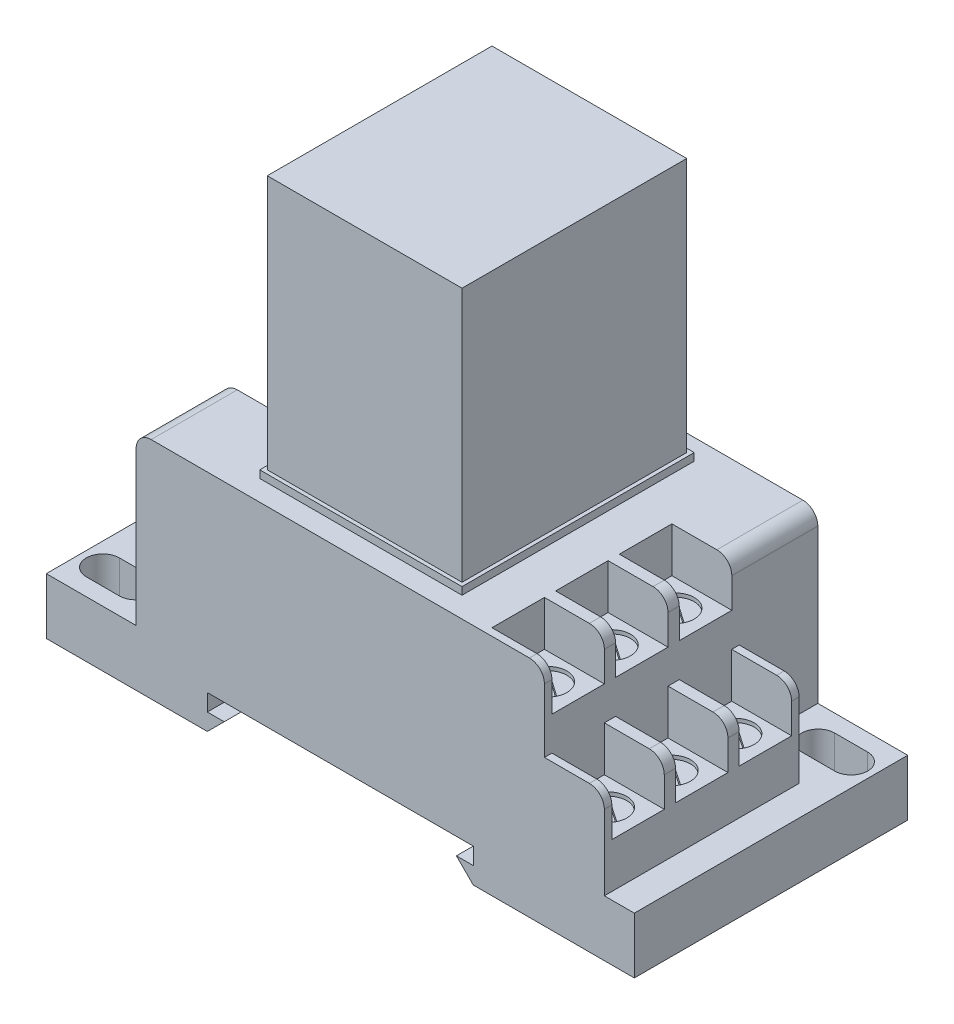
from build123d import *

# Parameters (mm, degrees)
SKETCH_1_W          = 78.5
SKETCH_1_H          = 36.5
EXTRUDE_1_DEPTH     = 30
CUT_EXTRUDE_1_DEPTH = 92.621504026
CUT_EXTRUDE_2_DEPTH = 92.621504026
EXTRUDE_2_DEPTH     = 26
EXTRUDE_6_DEPTH     = 26
CUT_EXTRUDE_3_DEPTH = 7.5
SKETCH_8_W          = 8
SKETCH_8_H          = 7
CUT_EXTRUDE_4_DEPTH = 6
SKETCH_9_W          = 8
SKETCH_9_H          = 7
CUT_EXTRUDE_5_DEPTH = 6
SKETCH_10_W         = 27
SKETCH_10_H         = 31
EXTRUDE_7_DEPTH     = 35
SKETCH_11_W         = 27
SKETCH_11_H         = 31
SKETCH_11_W_2       = 26
SKETCH_11_H_2       = 30
CUT_EXTRUDE_6_DEPTH = 34
SKETCH_12_W         = 8
SKETCH_12_H         = 7
SKETCH_12_H_2       = 7.017391642
CUT_EXTRUDE_7_DEPTH = 6
SKETCH_13_R         = 2.5
CUT_EXTRUDE_8_DEPTH = 1
EXTRUDE_8_DEPTH     = 0.5
SKETCH_15_R         = 2.5
CUT_EXTRUDE_9_DEPTH = 1
EXTRUDE_START       = 0.5
EXTRUDE_9_DEPTH     = 0.5


with BuildPart() as part:
    # Эскиз1 → Бобышка-Вытянуть1 (new body)
    with BuildSketch(Plane(origin=(0, 0, 0), x_dir=(1, 0, 0), z_dir=(0, 1, 0))):
        with Locations((39.25, 18.25)):
            Rectangle(SKETCH_1_W, SKETCH_1_H)
    extrude(amount=EXTRUDE_1_DEPTH)

    # Эскиз2 → Вырез-Вытянуть1 (cut, through all)
    with BuildSketch(Plane.XY):
        Polygon((21.5, 4.5), (57, 4.5), (57, 2.25), (54.75, 2.25), (57, 0), (21.5, 0), (23.75, 2.25), (21.5, 2.25), align=None)
    extrude(amount=-CUT_EXTRUDE_1_DEPTH, mode=Mode.SUBTRACT)

    # Эскиз3 → Вырез-Вытянуть2 (cut, through all)
    with BuildSketch(Plane.XY):
        with BuildLine():
            Line((0, 7.5), (12, 7.5))
            Line((12, 7.5), (12, 28))
            ThreePointArc((12, 28), (12.585786438, 29.414213562), (14, 30))
            Line((14, 30), (64.5, 30))
            ThreePointArc((64.5, 30), (65.914213562, 29.414213562), (66.5, 28))
            Line((66.5, 28), (66.5, 7.5))
            Line((66.5, 7.5), (78.5, 7.5))
            Line((78.5, 7.5), (78.5, 31.976678531))
            Line((78.5, 31.976678531), (0, 31.976678531))
            Line((0, 31.976678531), (0, 7.5))
        make_face()
    extrude(amount=-CUT_EXTRUDE_2_DEPTH, mode=Mode.SUBTRACT)

    # Эскиз7 → Вырез-Вытянуть3 (cut)
    with BuildSketch(Plane(origin=(0, 7.5, 0), x_dir=(1, 0, 0), z_dir=(0, 1, 0))):
        with BuildLine():
            Line((71.05, 34.2), (75.45, 34.2))
            ThreePointArc((75.45, 34.2), (77.65, 32), (75.45, 29.8))
            Line((75.45, 29.8), (71.05, 29.8))
            ThreePointArc((71.05, 29.8), (68.85, 32), (71.05, 34.2))
        make_face()
        with BuildLine():
            Line((3.05, 6.7), (7.45, 6.7))
            ThreePointArc((7.45, 6.7), (9.65, 4.5), (7.45, 2.3))
            Line((7.45, 2.3), (3.05, 2.3))
            ThreePointArc((3.05, 2.3), (0.85, 4.5), (3.05, 6.7))
        make_face()
    extrude(amount=-CUT_EXTRUDE_3_DEPTH, mode=Mode.SUBTRACT)

    # Эскиз10 → Бобышка-Вытянуть7 (add)
    with BuildSketch(Plane(origin=(0, 30, 0), x_dir=(1, 0, 0), z_dir=(0, 1, 0))):
        with Locations((39.25, 18.25)):
            Rectangle(SKETCH_10_W, SKETCH_10_H)
    extrude(amount=EXTRUDE_7_DEPTH)

    # Эскиз11 → Вырез-Вытянуть6 (cut)
    with BuildSketch(Plane(origin=(0, 65, 0), x_dir=(1, 0, 0), z_dir=(0, 1, 0))):
        with Locations((39.25, 18.25)):
            Rectangle(SKETCH_11_W, SKETCH_11_H)
        with Locations((39.25, 18.25)):
            Rectangle(SKETCH_11_W_2, SKETCH_11_H_2, mode=Mode.SUBTRACT)
    extrude(amount=-CUT_EXTRUDE_6_DEPTH, mode=Mode.SUBTRACT)

    # Эскиз12 → Вырез-Вытянуть7 (cut)
    with BuildSketch(Plane(origin=(0, 30, 0), x_dir=(1, 0, 0), z_dir=(0, 1, 0))):
        with Locations((16, 32)):
            Rectangle(SKETCH_12_W, SKETCH_12_H)
        with Locations((16, 23.5)):
            Rectangle(SKETCH_12_W, SKETCH_12_H)
        with Locations((16, 15)):
            Rectangle(SKETCH_12_W, SKETCH_12_H)
        with Locations((62.5, 4.5)):
            Rectangle(SKETCH_12_W, SKETCH_12_H)
        with Locations((62.5, 21.508695821)):
            Rectangle(SKETCH_12_W, SKETCH_12_H_2)
        with Locations((62.5, 13)):
            Rectangle(SKETCH_12_W, SKETCH_12_H)
    extrude(amount=-CUT_EXTRUDE_7_DEPTH, mode=Mode.SUBTRACT)



with BuildPart() as body_2:
    # Эскиз4 → Бобышка-Вытянуть2 (new body)
    with BuildSketch(Plane.XY):
        with BuildLine():
            Line((66.5, 7.5), (74.5, 7.5))
            Line((74.5, 7.5), (74.5, 17.5))
            ThreePointArc((74.5, 17.5), (73.914213562, 18.914213562), (72.5, 19.5))
            Line((72.5, 19.5), (66.5, 19.5))
            Line((66.5, 19.5), (66.5, 7.5))
        make_face()
    extrude(amount=-EXTRUDE_2_DEPTH)

    # Эскиз9 → Вырез-Вытянуть5 (cut)
    with BuildSketch(Plane(origin=(0, 19.5, 0), x_dir=(1, 0, 0), z_dir=(0, 1, 0))):
        with Locations((70.5, 21.5)):
            Rectangle(SKETCH_9_W, SKETCH_9_H)
        with Locations((70.5, 13)):
            Rectangle(SKETCH_9_W, SKETCH_9_H)
        with Locations((70.5, 4.5)):
            Rectangle(SKETCH_9_W, SKETCH_9_H)
    extrude(amount=-CUT_EXTRUDE_5_DEPTH, mode=Mode.SUBTRACT)


with BuildPart() as body_3:
    # Эскиз6 → Бобышка-Вытянуть6 (new body)
    with BuildSketch(Plane(origin=(0, 0, -36.5), x_dir=(-1, 0, 0), z_dir=(0, 0, -1))):
        with BuildLine():
            Line((-12, 7.5), (-4, 7.5))
            Line((-4, 7.5), (-4, 17.5))
            ThreePointArc((-4, 17.5), (-4.585786438, 18.914213562), (-6, 19.5))
            Line((-6, 19.5), (-12, 19.5))
            Line((-12, 19.5), (-12, 7.5))
        make_face()
    extrude(amount=-EXTRUDE_6_DEPTH)

    # Эскиз8 → Вырез-Вытянуть4 (cut)
    with BuildSketch(Plane(origin=(0, 19.5, 0), x_dir=(1, 0, 0), z_dir=(0, 1, 0))):
        with Locations((8, 15)):
            Rectangle(SKETCH_8_W, SKETCH_8_H)
        with Locations((8, 23.5)):
            Rectangle(SKETCH_8_W, SKETCH_8_H)
        with Locations((8, 32)):
            Rectangle(SKETCH_8_W, SKETCH_8_H)
    extrude(amount=-CUT_EXTRUDE_4_DEPTH, mode=Mode.SUBTRACT)


with BuildPart() as cut_extrude_8_tool:
    # Эскиз13 → Вырез-Вытянуть8 (new body)
    with BuildSketch(Plane(origin=(0, 13.5, 0), x_dir=(1, 0, 0), z_dir=(0, 1, 0))):
        with Locations(Location((8, 32, 0), (0, 0, 270))):
            Circle(SKETCH_13_R)
        with Locations(Location((8, 23.5, 0), (0, 0, 270))):
            Circle(SKETCH_13_R)
        with Locations(Location((8, 15, 0), (0, 0, 270))):
            Circle(SKETCH_13_R)
        with Locations(Location((70.5, 4.5, 0), (0, 0, 270))):
            Circle(SKETCH_13_R)
        with Locations(Location((70.5, 21.5, 0), (0, 0, 270))):
            Circle(SKETCH_13_R)
        with Locations(Location((70.5, 13, 0), (0, 0, 270))):
            Circle(SKETCH_13_R)
    extrude(amount=-CUT_EXTRUDE_8_DEPTH)


with BuildPart() as body_2_1:
    add(body_2.part)

    # Вырез-Вытянуть8: cut by cut_extrude_8_tool
    add(cut_extrude_8_tool.part, mode=Mode.SUBTRACT)


with BuildPart() as body_3_1:
    add(body_3.part)

    # Вырез-Вытянуть8: cut by cut_extrude_8_tool
    add(cut_extrude_8_tool.part, mode=Mode.SUBTRACT)


with BuildPart() as part_1:
    add(part.part)

    add(body_3_1.part)  # Бобышка-Вытянуть8 merges body 3

    add(body_2_1.part)  # Бобышка-Вытянуть8 merges body 2
    # Эскиз14 → Бобышка-Вытянуть8 (add)
    with BuildSketch(Plane(origin=(0, 12.5, 0), x_dir=(1, 0, 0), z_dir=(0, 1, 0))):
        with BuildLine():
            Line((68.195558501, 5.469303553), (72.240198321, 2.705087801))
            ThreePointArc((72.240198321, 2.705087801), (69.089392056, 2.435978385), (68.195558501, 5.469303553))
        make_face()
        with BuildLine():
            Line((68.759801679, 6.294912199), (72.804441499, 3.530696447))
            ThreePointArc((72.804441499, 3.530696447), (71.910607944, 6.564021615), (68.759801679, 6.294912199))
        make_face()
        with BuildLine():
            Line((68.759801679, 14.794912199), (72.804441499, 12.030696447))
            ThreePointArc((72.804441499, 12.030696447), (71.910607944, 15.064021615), (68.759801679, 14.794912199))
        make_face()
        with BuildLine():
            Line((68.195558501, 13.969303553), (72.240198321, 11.205087801))
            ThreePointArc((72.240198321, 11.205087801), (69.089392056, 10.935978385), (68.195558501, 13.969303553))
        make_face()
        with BuildLine():
            Line((68.759801679, 23.294912199), (72.804441499, 20.530696447))
            ThreePointArc((72.804441499, 20.530696447), (71.910607944, 23.564021615), (68.759801679, 23.294912199))
        make_face()
        with BuildLine():
            Line((68.195558501, 22.469303553), (72.240198321, 19.705087801))
            ThreePointArc((72.240198321, 19.705087801), (69.089392056, 19.435978385), (68.195558501, 22.469303553))
        make_face()
        with BuildLine():
            Line((5.695558501, 24.469303553), (9.740198321, 21.705087801))
            ThreePointArc((9.740198321, 21.705087801), (6.589392056, 21.435978385), (5.695558501, 24.469303553))
        make_face()
        with BuildLine():
            Line((6.259801679, 16.794912199), (10.304441499, 14.030696447))
            ThreePointArc((10.304441499, 14.030696447), (9.410607944, 17.064021615), (6.259801679, 16.794912199))
        make_face()
        with BuildLine():
            Line((6.259801679, 25.294912199), (10.304441499, 22.530696447))
            ThreePointArc((10.304441499, 22.530696447), (9.410607944, 25.564021615), (6.259801679, 25.294912199))
        make_face()
        with BuildLine():
            Line((5.695558501, 32.969303553), (9.740198321, 30.205087801))
            ThreePointArc((9.740198321, 30.205087801), (6.589392056, 29.935978385), (5.695558501, 32.969303553))
        make_face()
        with BuildLine():
            Line((5.695558501, 15.969303553), (9.740198321, 13.205087801))
            ThreePointArc((9.740198321, 13.205087801), (6.589392056, 12.935978385), (5.695558501, 15.969303553))
        make_face()
        with BuildLine():
            Line((6.259801679, 33.794912199), (10.304441499, 31.030696447))
            ThreePointArc((10.304441499, 31.030696447), (9.410607944, 34.064021615), (6.259801679, 33.794912199))
        make_face()
    extrude(amount=EXTRUDE_8_DEPTH)

    # Эскиз15 → Вырез-Вытянуть9 (cut)
    with BuildSketch(Plane(origin=(0, 24, 0), x_dir=(1, 0, 0), z_dir=(0, 1, 0))):
        with Locations(Location((16, 32, 0), (0, 0, 270))):
            Circle(SKETCH_15_R)
        with Locations(Location((16, 23.5, 0), (0, 0, 270))):
            Circle(SKETCH_15_R)
        with Locations(Location((16, 15, 0), (0, 0, 270))):
            Circle(SKETCH_15_R)
        with Locations(Location((62.5, 13, 0), (0, 0, 270))):
            Circle(SKETCH_15_R)
        with Locations(Location((62.5, 21.5, 0), (0, 0, 270))):
            Circle(SKETCH_15_R)
        with Locations(Location((62.5, 4.5, 0), (0, 0, 270))):
            Circle(SKETCH_15_R)
    extrude(amount=-CUT_EXTRUDE_9_DEPTH, mode=Mode.SUBTRACT)

    # Эскиз16 → Бобышка-Вытянуть9 (add)
    with BuildSketch(Plane(origin=(0, 23, 0), x_dir=(1, 0, 0), z_dir=(0, 1, 0)).offset(EXTRUDE_START)):
        with BuildLine():
            Line((13.70322737, 32.987337574), (17.726075098, 30.191502072))
            ThreePointArc((17.726075098, 30.191502072), (14.57325617, 29.947099115), (13.70322737, 32.987337574))
        make_face()
        with BuildLine():
            Line((14.273924902, 33.808497928), (18.29677263, 31.012662426))
            ThreePointArc((18.29677263, 31.012662426), (17.42674383, 34.052900885), (14.273924902, 33.808497928))
        make_face()
        with BuildLine():
            Line((13.70322737, 24.487337574), (17.726075098, 21.691502072))
            ThreePointArc((17.726075098, 21.691502072), (14.57325617, 21.447099115), (13.70322737, 24.487337574))
        make_face()
        with BuildLine():
            Line((14.273924902, 25.308497928), (18.29677263, 22.512662426))
            ThreePointArc((18.29677263, 22.512662426), (17.42674383, 25.552900885), (14.273924902, 25.308497928))
        make_face()
        with BuildLine():
            Line((13.70322737, 15.987337574), (17.726075098, 13.191502072))
            ThreePointArc((17.726075098, 13.191502072), (14.57325617, 12.947099115), (13.70322737, 15.987337574))
        make_face()
        with BuildLine():
            Line((14.273924902, 16.808497928), (18.29677263, 14.012662426))
            ThreePointArc((18.29677263, 14.012662426), (17.42674383, 17.052900885), (14.273924902, 16.808497928))
        make_face()
        with BuildLine():
            Line((60.773924902, 6.308497928), (64.79677263, 3.512662426))
            ThreePointArc((64.79677263, 3.512662426), (63.92674383, 6.552900885), (60.773924902, 6.308497928))
        make_face()
        with BuildLine():
            Line((60.773924902, 14.808497928), (64.79677263, 12.012662426))
            ThreePointArc((64.79677263, 12.012662426), (63.92674383, 15.052900885), (60.773924902, 14.808497928))
        make_face()
        with BuildLine():
            Line((60.20322737, 13.987337574), (64.226075098, 11.191502072))
            ThreePointArc((64.226075098, 11.191502072), (61.07325617, 10.947099115), (60.20322737, 13.987337574))
        make_face()
        with BuildLine():
            Line((60.773924902, 23.308497928), (64.79677263, 20.512662426))
            ThreePointArc((64.79677263, 20.512662426), (63.92674383, 23.552900885), (60.773924902, 23.308497928))
        make_face()
        with BuildLine():
            Line((60.20322737, 5.487337574), (64.226075098, 2.691502072))
            ThreePointArc((64.226075098, 2.691502072), (61.07325617, 2.447099115), (60.20322737, 5.487337574))
        make_face()
        with BuildLine():
            Line((60.20322737, 22.487337574), (64.226075098, 19.691502072))
            ThreePointArc((64.226075098, 19.691502072), (61.07325617, 19.447099115), (60.20322737, 22.487337574))
        make_face()
    extrude(amount=-EXTRUDE_9_DEPTH)


solid = part_1.part
